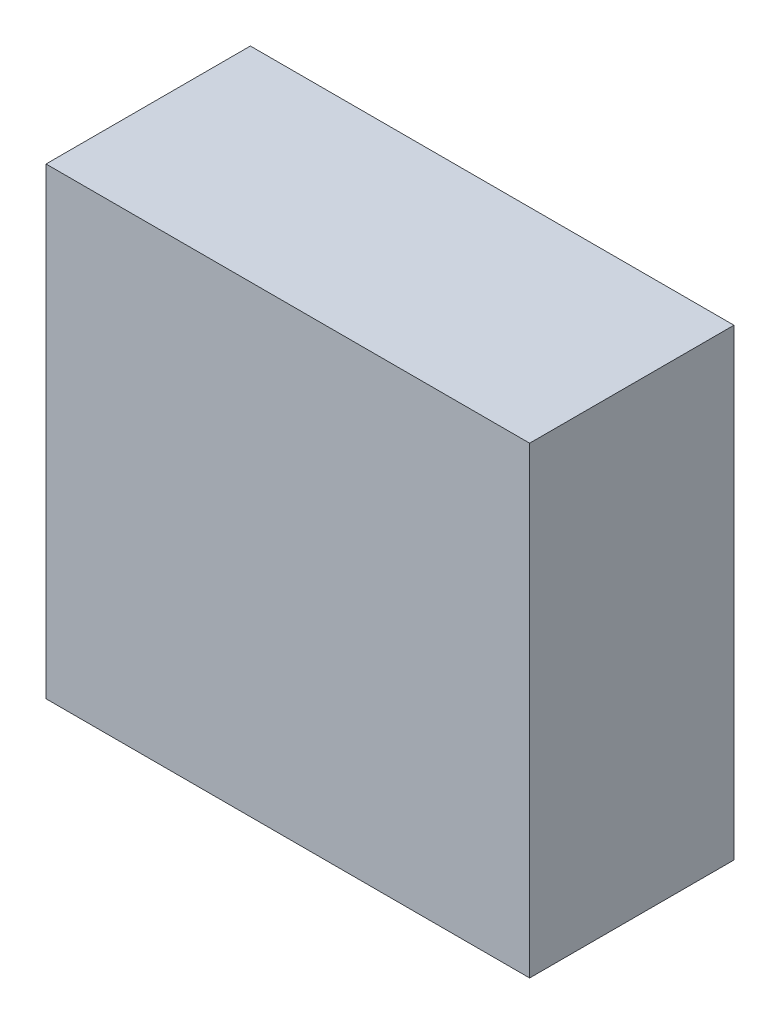
from build123d import *

# Parameters (mm, degrees)
SKETCH1_W           = 180.34
SKETCH1_H           = 76.2
BOSS_EXTRUDE1_DEPTH = 172.72


with BuildPart() as part:
    # Sketch1 → Boss-Extrude1 (new body)
    with BuildSketch(Plane(origin=(0, 0, 0), x_dir=(1, 0, 0), z_dir=(0, 1, 0))):
        Rectangle(SKETCH1_W, SKETCH1_H)
    extrude(amount=BOSS_EXTRUDE1_DEPTH)


solid = part.part
